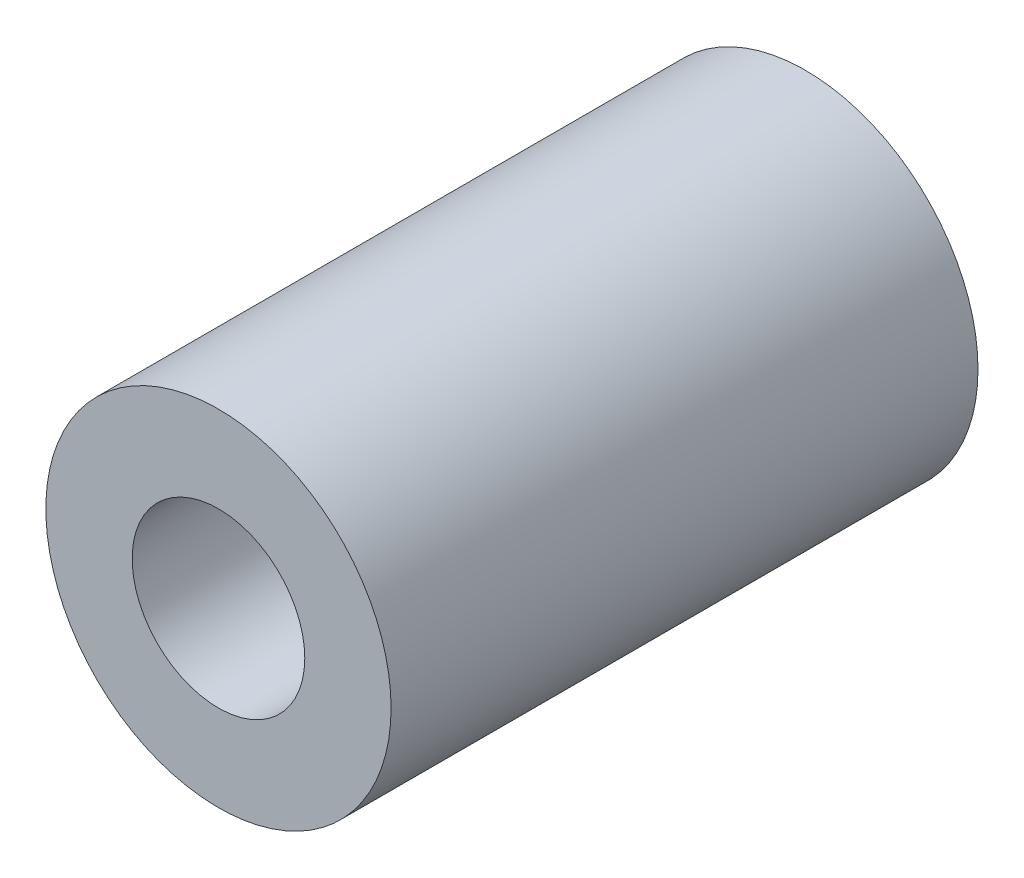
from build123d import *

# Parameters (mm, degrees)
SKETCH_8_R      = 50
SKETCH_8_R_2    = 25
EXTRUDE_1_DEPTH = 170


with BuildPart() as part:
    # 草图8 → 凸台-拉伸1 (new body)
    with BuildSketch(Plane.XY):
        Circle(SKETCH_8_R)
        Circle(SKETCH_8_R_2, mode=Mode.SUBTRACT)
    extrude(amount=EXTRUDE_1_DEPTH)


solid = part.part
